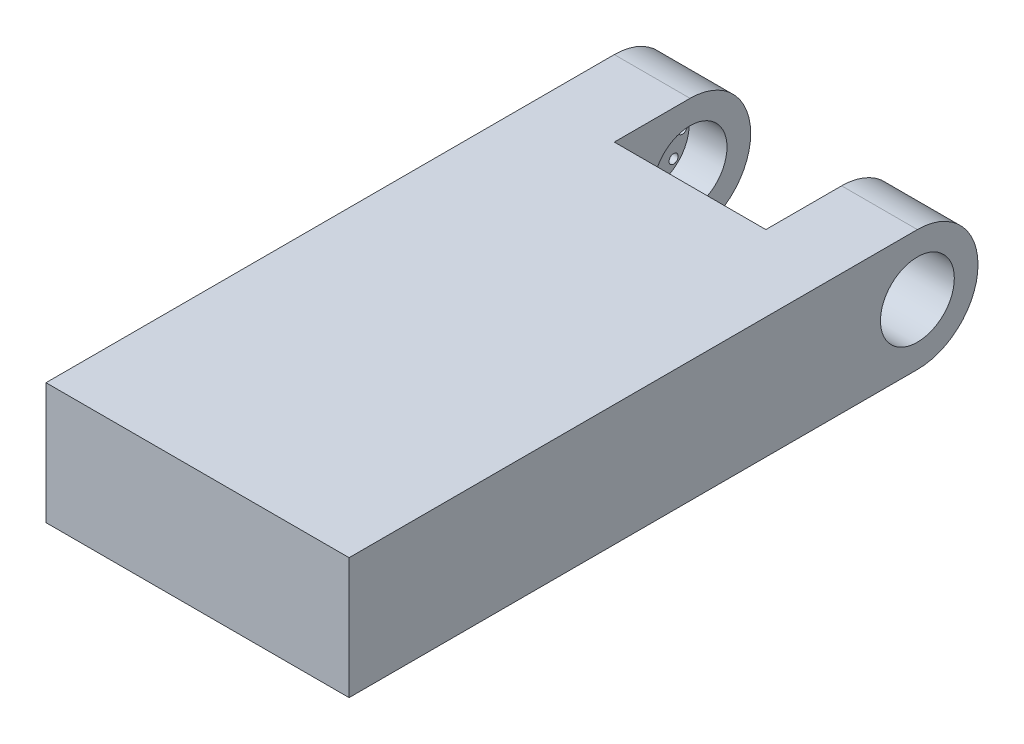
from build123d import *

# Parameters (mm, degrees)
BOSS_EXTRUDE1_DEPTH                           = 80
SKETCH2_W                                     = 40
SKETCH2_H                                     = 40
CUT_EXTRUDE1_DEPTH                            = 60
SKETCH3_R                                     = 9.75
CUT_EXTRUDE2_DEPTH                            = 70
CBORE_FOR_M2_CHEESE_SLOTTED_HEAD3_D           = 2.4
CBORE_FOR_M2_CHEESE_SLOTTED_HEAD3_CBORE_D     = 4.8
CBORE_FOR_M2_CHEESE_SLOTTED_HEAD3_CBORE_DEPTH = 1.4


with BuildPart() as part:
    # Sketch1 → Boss-Extrude1 (new body)
    with BuildSketch(Plane(origin=(0, 0, 0), x_dir=(0, 0, -1), z_dir=(1, 0, 0))):
        with BuildLine():
            Line((0, 0), (150, 0))
            ThreePointArc((150, 0), (166, 16), (150, 32))
            Line((150, 32), (0, 32))
            Line((0, 32), (0, 0))
        make_face()
    extrude(amount=BOSS_EXTRUDE1_DEPTH)

    # Sketch2 → Cut-Extrude1 (cut)
    with BuildSketch(Plane(origin=(0, 32, 0), x_dir=(1, 0, 0), z_dir=(0, 1, 0))):
        with Locations((40, 150)):
            Rectangle(SKETCH2_W, SKETCH2_H)
    extrude(amount=-CUT_EXTRUDE1_DEPTH, mode=Mode.SUBTRACT)

    # Sketch3 → Cut-Extrude2 (cut)
    with BuildSketch(Plane(origin=(80, 0, 0), x_dir=(0, 0, -1), z_dir=(1, 0, 0))):
        with Locations((150, 16)):
            Circle(SKETCH3_R)
    extrude(amount=-CUT_EXTRUDE2_DEPTH, mode=Mode.SUBTRACT)

    # CBORE for M2 Cheese Slotted Head3 (through all)
    with Locations(Plane(origin=(0, 24, -150), x_dir=(0, 0, -1), z_dir=(-1, 0, 0))):
        with Locations((0, 0), (-5.656854249, 2.343145751), (-8, 8), (-5.656854249, 13.656854249), (0, 16), (5.656854249, 13.656854249), (8, 8), (5.656854249, 2.343145751)):
            CounterBoreHole(CBORE_FOR_M2_CHEESE_SLOTTED_HEAD3_D / 2, CBORE_FOR_M2_CHEESE_SLOTTED_HEAD3_CBORE_D / 2, CBORE_FOR_M2_CHEESE_SLOTTED_HEAD3_CBORE_DEPTH)


solid = part.part
